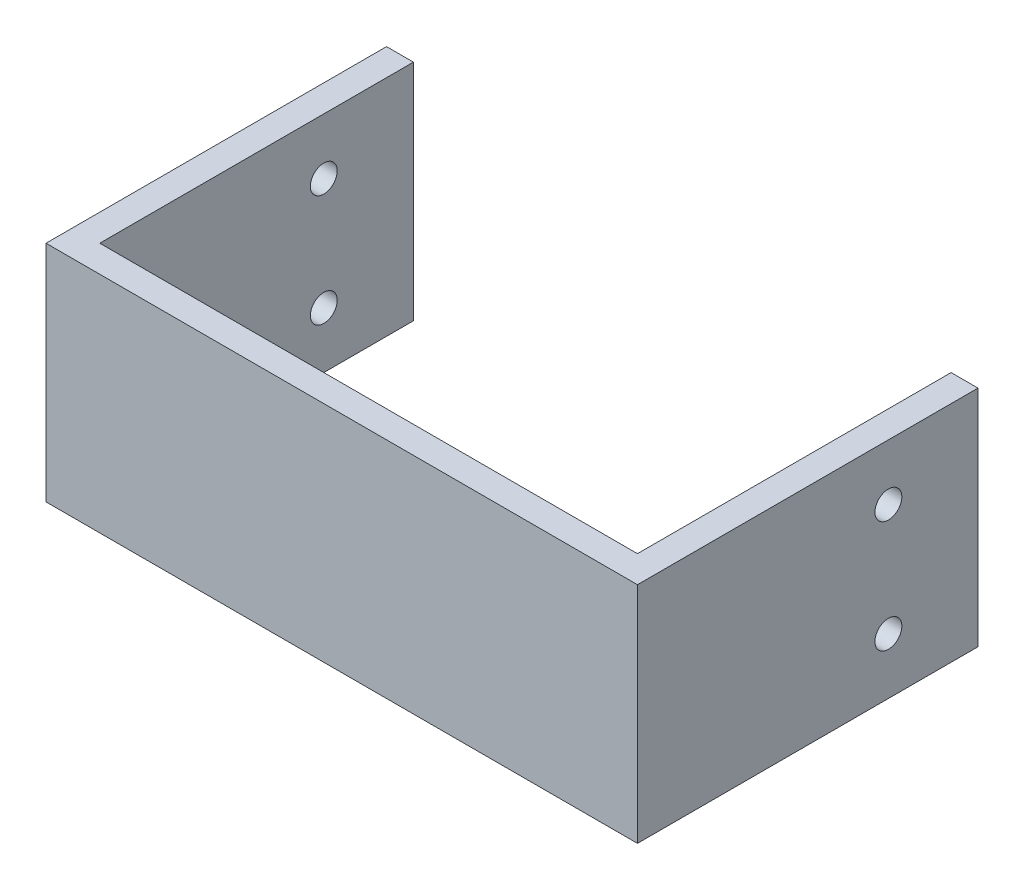
from build123d import *

# Parameters (mm, degrees)
SKETCH_1_W          = 66
SKETCH_1_H          = 25
EXTRUDE_1_DEPTH     = 3
SKETCH_2_W          = 3
SKETCH_2_H          = 25
EXTRUDE_2_DEPTH     = 35
SKETCH_3_R          = 1.5
CUT_EXTRUDE_1_DEPTH = 79.778169565


with BuildPart() as part:
    # 草图1 → 凸台-拉伸1 (new body)
    with BuildSketch(Plane.XY):
        with Locations((33, -12.5)):
            Rectangle(SKETCH_1_W, SKETCH_1_H)
    extrude(amount=EXTRUDE_1_DEPTH)

    # 草图2 → 凸台-拉伸2 (add)
    with BuildSketch(Plane(origin=(0, 0, 0), x_dir=(-1, 0, 0), z_dir=(0, 0, -1))):
        with Locations((-1.5, -12.5)):
            Rectangle(SKETCH_2_W, SKETCH_2_H)
        with Locations((-64.5, -12.5)):
            Rectangle(SKETCH_2_W, SKETCH_2_H)
    extrude(amount=EXTRUDE_2_DEPTH)

    # 草图3 → 切除-拉伸1 (cut, through all)
    with BuildSketch(Plane.ZY):
        with Locations(Location((-25, -6.25, 0), (0, 0, 270))):
            Circle(SKETCH_3_R)
        with Locations((-25, -18.75)):
            Circle(SKETCH_3_R)
    extrude(amount=-CUT_EXTRUDE_1_DEPTH, mode=Mode.SUBTRACT)


solid = part.part
